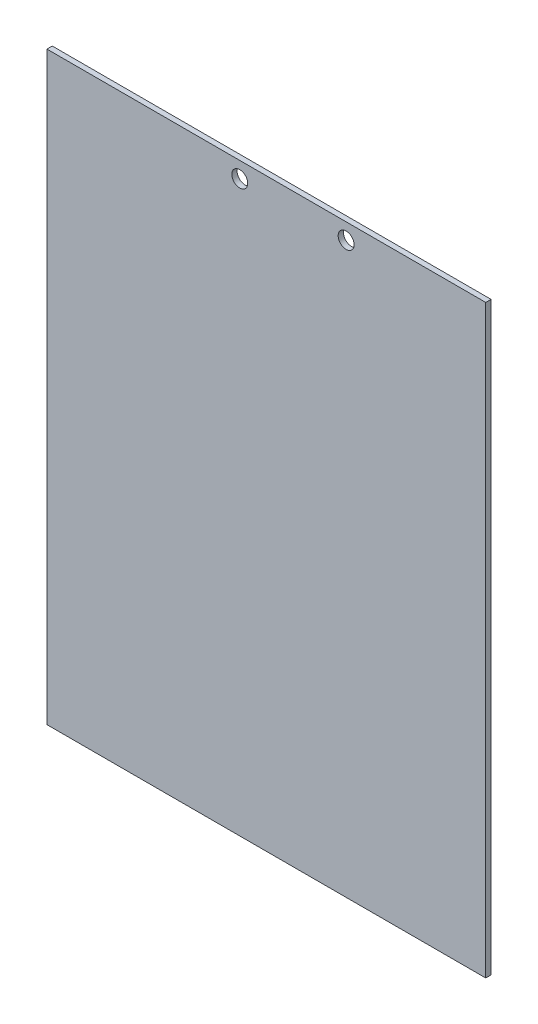
from build123d import *

# Parameters (mm, degrees)
SKETCH_1_W      = 82.5
SKETCH_1_H      = 110
SKETCH_1_R      = 1.5
EXTRUDE_1_DEPTH = 1


with BuildPart() as part:
    # 草图1 → 凸台-拉伸1 (new body)
    with BuildSketch(Plane.XY):
        with Locations((41.25, 55)):
            Rectangle(SKETCH_1_W, SKETCH_1_H)
        with Locations((36.25, 107)):
            Circle(SKETCH_1_R, mode=Mode.SUBTRACT)
        with Locations((56.25, 107)):
            Circle(SKETCH_1_R, mode=Mode.SUBTRACT)
    extrude(amount=EXTRUDE_1_DEPTH)


solid = part.part
